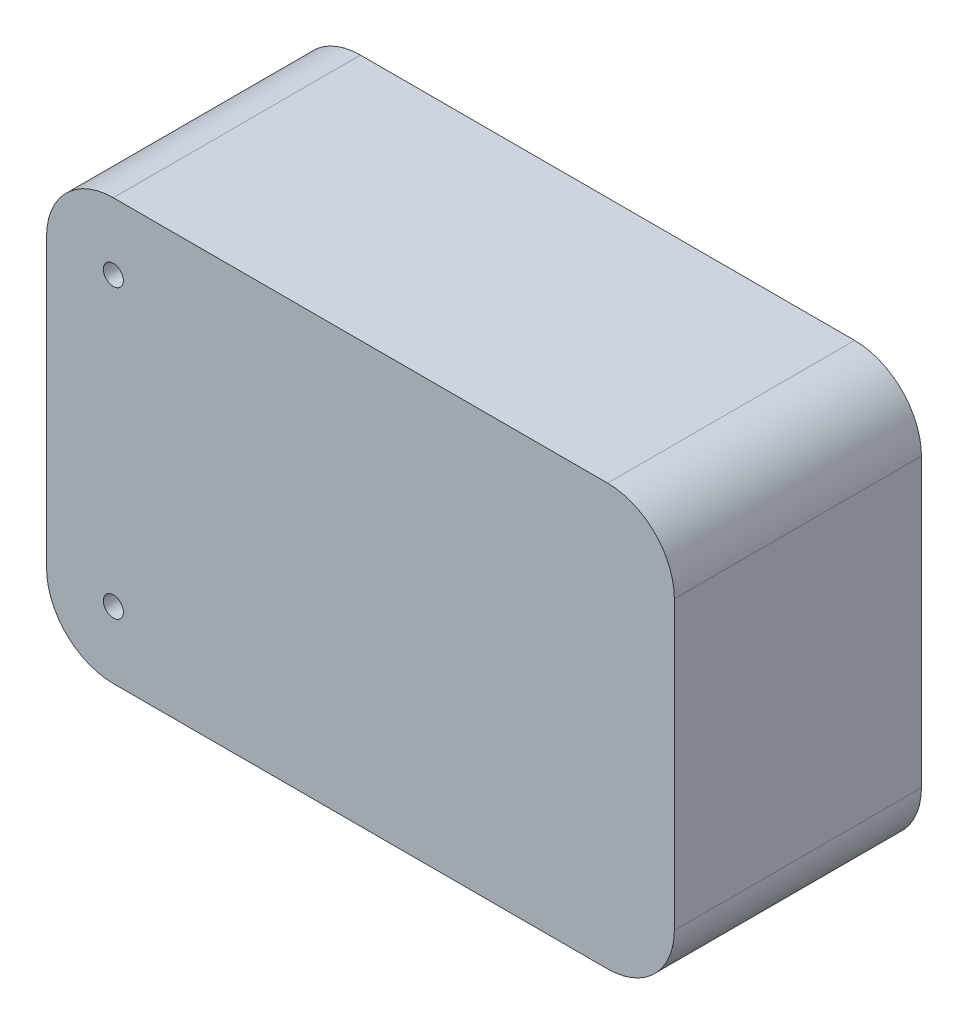
from build123d import *

# Parameters (mm, degrees)
SKETCH_1_W          = 94
SKETCH_1_H          = 63
EXTRUDE_1_DEPTH     = 37
FILLET_1_R          = 10
SKETCH_3_R          = 1.5
CUT_EXTRUDE_1_DEPTH = 10


with BuildPart() as part:
    # 草图1 → 凸台-拉伸1 (new body)
    with BuildSketch(Plane.XY):
        with Locations((-2.555555556, -0.5)):
            Rectangle(SKETCH_1_W, SKETCH_1_H)
    extrude(amount=EXTRUDE_1_DEPTH)

    # 圆角1
    fillet_1_edges = [part.edges().sort_by_distance(p)[0] for p in [
        (-49.555555556, 31, 18.5),
        (44.444444444, 31, 18.5),
        (44.444444444, -32, 18.5),
        (-49.555555556, -32, 18.5),
    ]]
    fillet(fillet_1_edges, radius=FILLET_1_R)

    # 草图3 → 切除-拉伸1 (cut)
    with BuildSketch(Plane.XY.offset(37)):
        with Locations((-39.555555556, -22)):
            Circle(SKETCH_3_R)
        with Locations((-39.555555556, 21)):
            Circle(SKETCH_3_R)
    extrude(amount=-CUT_EXTRUDE_1_DEPTH, mode=Mode.SUBTRACT)


solid = part.part
